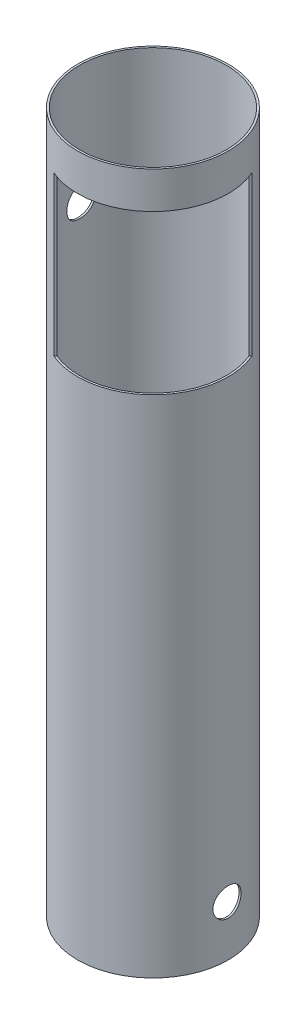
from build123d import *

# Parameters (mm, degrees)
CROQUIS1_R              = 57
CROQUIS1_R_2            = 55.5
SALIENTE_EXTRUIR1_DEPTH = 530
CROQUIS2_R              = 10.65
CORTAR_EXTRUIR1_DEPTH   = 10
CROQUIS3_R              = 10.65
CORTAR_EXTRUIR3_DEPTH   = 10
CROQUIS4_W              = 120
CROQUIS4_H              = 120
CORTAR_EXTRUIR4_DEPTH   = 36
CORTAR_EXTRUIR5_DEPTH   = 36


with BuildPart() as part:
    # Croquis1 → Saliente-Extruir1 (new body)
    with BuildSketch(Plane(origin=(0, 0, 0), x_dir=(1, 0, 0), z_dir=(0, 1, 0))):
        with Locations(Location((0, 0, 0), (0, 0, 270))):
            Circle(CROQUIS1_R)
        with Locations(Location((0, 0, 0), (0, 0, 270))):
            Circle(CROQUIS1_R_2, mode=Mode.SUBTRACT)
    extrude(amount=SALIENTE_EXTRUIR1_DEPTH)

    # Croquis2 → Cortar-Extruir1 (cut)
    with BuildSketch(Plane.ZY.offset(57)):
        with Locations((0, 440)):
            Circle(CROQUIS2_R)
    extrude(amount=-CORTAR_EXTRUIR1_DEPTH, mode=Mode.SUBTRACT)

    # Croquis3 → Cortar-Extruir3 (cut)
    with BuildSketch(Plane(origin=(57, 0, 0), x_dir=(0, 0, -1), z_dir=(1, 0, 0))):
        with Locations((0, 38.1)):
            Circle(CROQUIS3_R)
    extrude(amount=-CORTAR_EXTRUIR3_DEPTH, mode=Mode.SUBTRACT)

    # Croquis4 → Cortar-Extruir4 (cut)
    with BuildSketch(Plane(origin=(40.305086528, 0, 40.305086528), x_dir=(0, -1, 0), z_dir=(0.7071067811865464, 0, 0.7071067811865488))):
        with Locations((-442.099170551, 0)):
            Rectangle(CROQUIS4_W, CROQUIS4_H)
    extrude(amount=-CORTAR_EXTRUIR4_DEPTH, mode=Mode.SUBTRACT)

    # Croquis6 → Cortar-Extruir5 (cut)
    with BuildSketch(Plane.ZY.offset(57)):
        with BuildLine():
            Line((4.146980327, 136.214628742), (-0.063914709, 136.214628742))
            add(Edge.make_bspline(
                [(-0.063914709, 136.214628742), (-0.467287481, 135.678507753), (-0.558467191, 135.016456308)],
                knots=[5.643669724, 5.643669724, 5.643669724, 6.14786855, 6.14786855, 6.14786855], degree=2, weights=[1, 0.968390884, 1]))
            add(Edge.make_bspline(
                [(-0.558467191, 135.016456308), (-0.963914609, 132.027107364), (2.041532809, 132.027107364), (5.046980227, 132.027107364), (4.641532809, 135.016456308)],
                knots=[4.577072223, 4.577072223, 4.577072223, 6.283185307, 6.283185307, 7.989298391, 7.989298391, 7.989298391], degree=2, weights=[1, 0.657683746, 1, 0.657683746, 1]))
            add(Edge.make_bspline(
                [(4.641532809, 135.016456308), (4.550353099, 135.678507753), (4.146980327, 136.214628742)],
                knots=[3.276909411, 3.276909411, 3.276909411, 3.781108237, 3.781108237, 3.781108237], degree=2, weights=[1, 0.968390884, 1]))
        make_face()
    extrude(amount=-CORTAR_EXTRUIR5_DEPTH, mode=Mode.SUBTRACT)


solid = part.part
